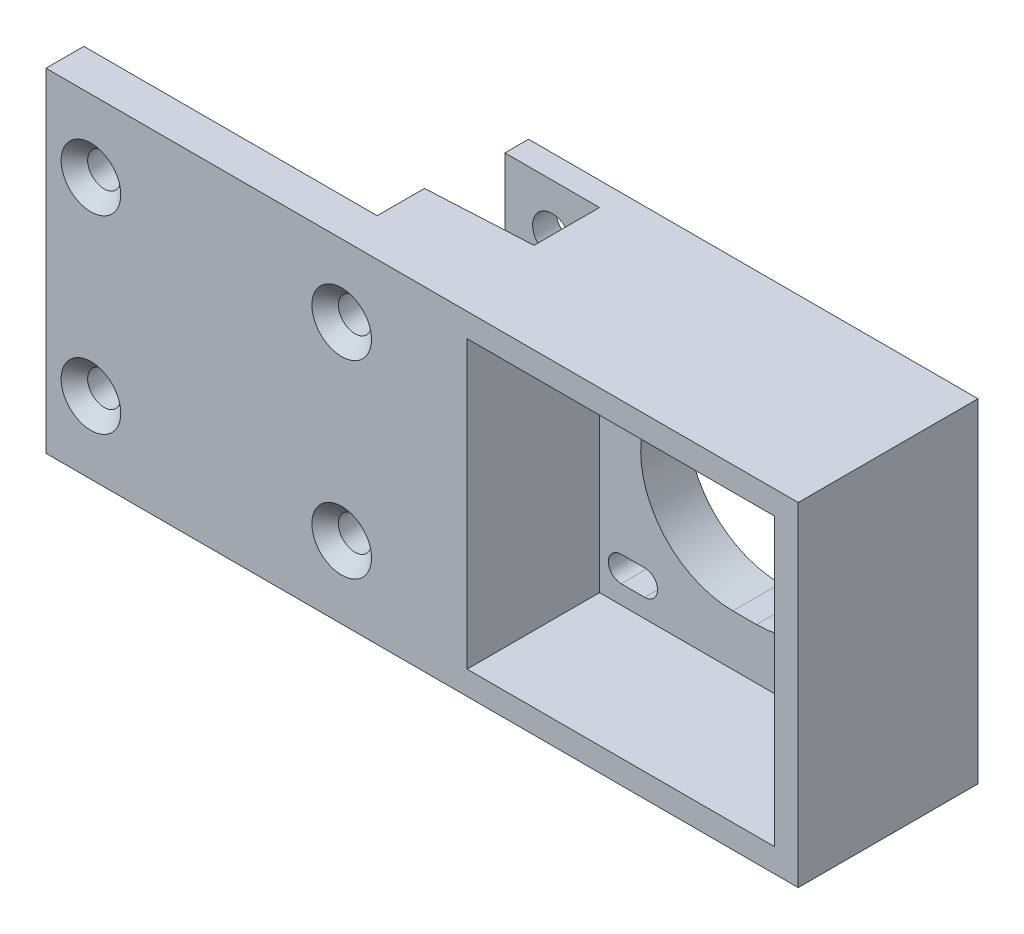
from build123d import *

# Parameters (mm, degrees)
SKETCH1_W                                           = 89
SKETCH1_H                                           = 70.5
SKETCH1_R                                           = 2.5
BOSS_EXTRUDE1_DEPTH                                 = 8
SKETCH2_W                                           = 38
SKETCH2_H                                           = 70.5
BOSS_EXTRUDE2_DEPTH                                 = 5
BOSS_EXTRUDE3_DEPTH                                 = 5
SKETCH17_W                                          = 65
SKETCH17_H                                          = 70.5
BOSS_EXTRUDE6_DEPTH                                 = 5
CUT_EXTRUDE1_REACH                                  = 171.004
SKETCH7_R                                           = 4.15
CUT_EXTRUDE1_DIRECTION_2_REACH                      = 171.004
CSK_FOR_M6_COUNTERSUNK_FLAT_HEAD_SCREW1_D           = 7
CSK_FOR_M6_COUNTERSUNK_FLAT_HEAD_SCREW1_DEPTH       = 8
CSK_FOR_M6_COUNTERSUNK_FLAT_HEAD_SCREW1_CSINK_D     = 12.6
CSK_FOR_M6_COUNTERSUNK_FLAT_HEAD_SCREW1_CSINK_ANGLE = 90
CSK_FOR_M6_COUNTERSUNK_FLAT_HEAD_SCREW1_TIP         = 2.103012167
RIB5_REACH                                          = 128.754
SKETCH15_WALL_W                                     = 280.507889424
SKETCH15_WALL_H                                     = 5
RIB5_DRAFT_ANGLE                                    = 20
SKETCH16_W                                          = 5
SKETCH16_H                                          = 38
BOSS_EXTRUDE5_DEPTH                                 = 70.5
RIB1_REACH                                          = 146.911
SKETCH6_WALL_W                                      = 356.822359386
SKETCH6_WALL_H                                      = 5
SKETCH19_W                                          = 22
SKETCH19_H                                          = 10
BOSS_EXTRUDE7_DEPTH                                 = 7
FILLET1_R                                           = 2.5


with BuildPart() as part:
    # Sketch1 → Boss-Extrude1 (new body)
    with BuildSketch(Plane.XY):
        with Locations((8.5, 81.151)):
            Rectangle(SKETCH1_W, SKETCH1_H)
        with Locations((26.5, 61.151)):
            Circle(SKETCH1_R, mode=Mode.SUBTRACT)
        with Locations((-26.5, 61.151)):
            Circle(SKETCH1_R, mode=Mode.SUBTRACT)
        with Locations((-26.5, 101.151)):
            Circle(SKETCH1_R, mode=Mode.SUBTRACT)
        with Locations((26.5, 101.151)):
            Circle(SKETCH1_R, mode=Mode.SUBTRACT)
    extrude(amount=BOSS_EXTRUDE1_DEPTH)

    # Sketch2 → Boss-Extrude2 (add)
    with BuildSketch(Plane(origin=(53, 0, 0), x_dir=(0, 0, -1), z_dir=(1, 0, 0))):
        with Locations((11, 81.151)):
            Rectangle(SKETCH2_W, SKETCH2_H)
    extrude(amount=-BOSS_EXTRUDE2_DEPTH)

    # Sketch3 → Boss-Extrude3 (add)
    with BuildSketch(Plane(origin=(0, 0, -30), x_dir=(-1, 0, 0), z_dir=(0, 0, -1))):
        Polygon((-48, 45.901), (-118, 45.901), (-118, 116.401), (-48, 116.401), (-28, 116.401), (-28, 45.901), align=None)
    extrude(amount=-BOSS_EXTRUDE3_DEPTH)

    # Sketch17 → Boss-Extrude6 (add)
    with BuildSketch(Plane.XY.offset(-25)):
        with Locations((85.5, 81.151)):
            Rectangle(SKETCH17_W, SKETCH17_H)
    extrude(amount=BOSS_EXTRUDE6_DEPTH)

    # Sketch7 → Cut-Extrude1 (cut, up to next)
    with BuildSketch(Plane.XY.offset(-25), mode=Mode.PRIVATE) as cut_extrude1_sk1:
        with BuildLine():
            ThreePointArc((81.2, 100.651), (61.7, 81.151), (81.2, 61.651))
            Line((81.2, 61.651), (86.2, 61.651))
            ThreePointArc((86.2, 61.651), (105.7, 81.151), (86.2, 100.651))
            Line((86.2, 100.651), (81.2, 100.651))
        make_face()
    cut_extrude1_tool1 = extrude(cut_extrude1_sk1.sketch, amount=-CUT_EXTRUDE1_REACH, mode=Mode.PRIVATE) & part.part
    # Sketch7 → Cut-Extrude1 (cut, up to next)
    with BuildSketch(Plane.XY.offset(-25), mode=Mode.PRIVATE) as cut_extrude1_sk2:
        with BuildLine():
            Line((62.57, 107.481), (57.57, 107.481))
            ThreePointArc((57.57, 107.481), (54.87, 104.781), (57.57, 102.081))
            Line((57.57, 102.081), (62.57, 102.081))
            ThreePointArc((62.57, 102.081), (65.27, 104.781), (62.57, 107.481))
        make_face()
    cut_extrude1_tool2 = extrude(cut_extrude1_sk2.sketch, amount=-CUT_EXTRUDE1_REACH, mode=Mode.PRIVATE) & part.part
    # Sketch7 → Cut-Extrude1 (cut, up to next)
    with BuildSketch(Plane.XY.offset(-25), mode=Mode.PRIVATE) as cut_extrude1_sk3:
        with BuildLine():
            ThreePointArc((104.83, 107.481), (102.13, 104.781), (104.83, 102.081))
            Line((104.83, 102.081), (109.83, 102.081))
            ThreePointArc((109.83, 102.081), (112.53, 104.781), (109.83, 107.481))
            Line((109.83, 107.481), (104.83, 107.481))
        make_face()
    cut_extrude1_tool3 = extrude(cut_extrude1_sk3.sketch, amount=-CUT_EXTRUDE1_REACH, mode=Mode.PRIVATE) & part.part
    # Sketch7 → Cut-Extrude1 (cut, up to next)
    with BuildSketch(Plane.XY.offset(-25), mode=Mode.PRIVATE) as cut_extrude1_sk4:
        with BuildLine():
            Line((104.83, 54.821), (109.83, 54.821))
            ThreePointArc((109.83, 54.821), (112.53, 57.521), (109.83, 60.221))
            Line((109.83, 60.221), (104.83, 60.221))
            ThreePointArc((104.83, 60.221), (102.13, 57.521), (104.83, 54.821))
        make_face()
    cut_extrude1_tool4 = extrude(cut_extrude1_sk4.sketch, amount=-CUT_EXTRUDE1_REACH, mode=Mode.PRIVATE) & part.part
    # Sketch7 → Cut-Extrude1 (cut, up to next)
    with BuildSketch(Plane.XY.offset(-25), mode=Mode.PRIVATE) as cut_extrude1_sk5:
        with BuildLine():
            ThreePointArc((62.57, 54.821), (65.27, 57.521), (62.57, 60.221))
            Line((62.57, 60.221), (57.57, 60.221))
            ThreePointArc((57.57, 60.221), (54.87, 57.521), (57.57, 54.821))
            Line((57.57, 54.821), (62.57, 54.821))
        make_face()
    cut_extrude1_tool5 = extrude(cut_extrude1_sk5.sketch, amount=-CUT_EXTRUDE1_REACH, mode=Mode.PRIVATE) & part.part
    # Sketch7 → Cut-Extrude1 (cut, up to next)
    with BuildSketch(Plane.XY.offset(-25), mode=Mode.PRIVATE) as cut_extrude1_sk6:
        with Locations(Location((38, 106.151, 0), (0, 0, 90))):
            Circle(SKETCH7_R)
    cut_extrude1_tool6 = extrude(cut_extrude1_sk6.sketch, amount=-CUT_EXTRUDE1_REACH, mode=Mode.PRIVATE) & part.part
    # Sketch7 → Cut-Extrude1 (cut, up to next)
    with BuildSketch(Plane.XY.offset(-25), mode=Mode.PRIVATE) as cut_extrude1_sk7:
        with Locations(Location((38, 56.151, 0), (0, 0, 90))):
            Circle(SKETCH7_R)
    cut_extrude1_tool7 = extrude(cut_extrude1_sk7.sketch, amount=-CUT_EXTRUDE1_REACH, mode=Mode.PRIVATE) & part.part
    add(cut_extrude1_tool1.solids().sort_by_distance((83.7, 81.151, -25))[0], mode=Mode.SUBTRACT)
    add(cut_extrude1_tool2.solids().sort_by_distance((60.07, 104.781, -25))[0], mode=Mode.SUBTRACT)
    add(cut_extrude1_tool3.solids().sort_by_distance((107.33, 104.781, -25))[0], mode=Mode.SUBTRACT)
    add(cut_extrude1_tool4.solids().sort_by_distance((107.33, 57.521, -25))[0], mode=Mode.SUBTRACT)
    add(cut_extrude1_tool5.solids().sort_by_distance((60.07, 57.521, -25))[0], mode=Mode.SUBTRACT)
    add(cut_extrude1_tool6.solids().sort_by_distance((38, 106.151, -25))[0], mode=Mode.SUBTRACT)
    add(cut_extrude1_tool7.solids().sort_by_distance((38, 56.151, -25))[0], mode=Mode.SUBTRACT)

    # Cut-Extrude1 direction 2: up to this face of the body (flat: up to its plane)
    cut_extrude1_direction_2_end = Plane(part.part.faces().sort_by_distance((85.5, 81.151, -20))[0])
    # Sketch7 → Cut-Extrude1 direction 2 (cut, up to the picked face)
    with BuildSketch(Plane.XY.offset(-25), mode=Mode.PRIVATE) as cut_extrude1_direction_2_sk1:
        with BuildLine():
            ThreePointArc((81.2, 100.651), (61.7, 81.151), (81.2, 61.651))
            Line((81.2, 61.651), (86.2, 61.651))
            ThreePointArc((86.2, 61.651), (105.7, 81.151), (86.2, 100.651))
            Line((86.2, 100.651), (81.2, 100.651))
        make_face()
    cut_extrude1_direction_2_tool1 = split(extrude(cut_extrude1_direction_2_sk1.sketch, amount=CUT_EXTRUDE1_DIRECTION_2_REACH, mode=Mode.PRIVATE), bisect_by=cut_extrude1_direction_2_end, keep=Keep.BOTH, mode=Mode.PRIVATE)
    # Sketch7 → Cut-Extrude1 direction 2 (cut, up to the picked face)
    with BuildSketch(Plane.XY.offset(-25), mode=Mode.PRIVATE) as cut_extrude1_direction_2_sk2:
        with BuildLine():
            Line((62.57, 107.481), (57.57, 107.481))
            ThreePointArc((57.57, 107.481), (54.87, 104.781), (57.57, 102.081))
            Line((57.57, 102.081), (62.57, 102.081))
            ThreePointArc((62.57, 102.081), (65.27, 104.781), (62.57, 107.481))
        make_face()
    cut_extrude1_direction_2_tool2 = split(extrude(cut_extrude1_direction_2_sk2.sketch, amount=CUT_EXTRUDE1_DIRECTION_2_REACH, mode=Mode.PRIVATE), bisect_by=cut_extrude1_direction_2_end, keep=Keep.BOTH, mode=Mode.PRIVATE)
    # Sketch7 → Cut-Extrude1 direction 2 (cut, up to the picked face)
    with BuildSketch(Plane.XY.offset(-25), mode=Mode.PRIVATE) as cut_extrude1_direction_2_sk3:
        with BuildLine():
            ThreePointArc((104.83, 107.481), (102.13, 104.781), (104.83, 102.081))
            Line((104.83, 102.081), (109.83, 102.081))
            ThreePointArc((109.83, 102.081), (112.53, 104.781), (109.83, 107.481))
            Line((109.83, 107.481), (104.83, 107.481))
        make_face()
    cut_extrude1_direction_2_tool3 = split(extrude(cut_extrude1_direction_2_sk3.sketch, amount=CUT_EXTRUDE1_DIRECTION_2_REACH, mode=Mode.PRIVATE), bisect_by=cut_extrude1_direction_2_end, keep=Keep.BOTH, mode=Mode.PRIVATE)
    # Sketch7 → Cut-Extrude1 direction 2 (cut, up to the picked face)
    with BuildSketch(Plane.XY.offset(-25), mode=Mode.PRIVATE) as cut_extrude1_direction_2_sk4:
        with BuildLine():
            Line((104.83, 54.821), (109.83, 54.821))
            ThreePointArc((109.83, 54.821), (112.53, 57.521), (109.83, 60.221))
            Line((109.83, 60.221), (104.83, 60.221))
            ThreePointArc((104.83, 60.221), (102.13, 57.521), (104.83, 54.821))
        make_face()
    cut_extrude1_direction_2_tool4 = split(extrude(cut_extrude1_direction_2_sk4.sketch, amount=CUT_EXTRUDE1_DIRECTION_2_REACH, mode=Mode.PRIVATE), bisect_by=cut_extrude1_direction_2_end, keep=Keep.BOTH, mode=Mode.PRIVATE)
    # Sketch7 → Cut-Extrude1 direction 2 (cut, up to the picked face)
    with BuildSketch(Plane.XY.offset(-25), mode=Mode.PRIVATE) as cut_extrude1_direction_2_sk5:
        with BuildLine():
            ThreePointArc((62.57, 54.821), (65.27, 57.521), (62.57, 60.221))
            Line((62.57, 60.221), (57.57, 60.221))
            ThreePointArc((57.57, 60.221), (54.87, 57.521), (57.57, 54.821))
            Line((57.57, 54.821), (62.57, 54.821))
        make_face()
    cut_extrude1_direction_2_tool5 = split(extrude(cut_extrude1_direction_2_sk5.sketch, amount=CUT_EXTRUDE1_DIRECTION_2_REACH, mode=Mode.PRIVATE), bisect_by=cut_extrude1_direction_2_end, keep=Keep.BOTH, mode=Mode.PRIVATE)
    # Sketch7 → Cut-Extrude1 direction 2 (cut, up to the picked face)
    with BuildSketch(Plane.XY.offset(-25), mode=Mode.PRIVATE) as cut_extrude1_direction_2_sk6:
        with Locations(Location((38, 106.151, 0), (0, 0, 90))):
            Circle(SKETCH7_R)
    cut_extrude1_direction_2_tool6 = split(extrude(cut_extrude1_direction_2_sk6.sketch, amount=CUT_EXTRUDE1_DIRECTION_2_REACH, mode=Mode.PRIVATE), bisect_by=cut_extrude1_direction_2_end, keep=Keep.BOTH, mode=Mode.PRIVATE)
    # Sketch7 → Cut-Extrude1 direction 2 (cut, up to the picked face)
    with BuildSketch(Plane.XY.offset(-25), mode=Mode.PRIVATE) as cut_extrude1_direction_2_sk7:
        with Locations(Location((38, 56.151, 0), (0, 0, 90))):
            Circle(SKETCH7_R)
    cut_extrude1_direction_2_tool7 = split(extrude(cut_extrude1_direction_2_sk7.sketch, amount=CUT_EXTRUDE1_DIRECTION_2_REACH, mode=Mode.PRIVATE), bisect_by=cut_extrude1_direction_2_end, keep=Keep.BOTH, mode=Mode.PRIVATE)
    add(cut_extrude1_direction_2_tool1.solids().sort_by(Axis((83.7, 81.151, -25), (0, 0, 1)))[0], mode=Mode.SUBTRACT)
    add(cut_extrude1_direction_2_tool2.solids().sort_by(Axis((60.07, 104.781, -25), (0, 0, 1)))[0], mode=Mode.SUBTRACT)
    add(cut_extrude1_direction_2_tool3.solids().sort_by(Axis((107.33, 104.781, -25), (0, 0, 1)))[0], mode=Mode.SUBTRACT)
    add(cut_extrude1_direction_2_tool4.solids().sort_by(Axis((107.33, 57.521, -25), (0, 0, 1)))[0], mode=Mode.SUBTRACT)
    add(cut_extrude1_direction_2_tool5.solids().sort_by(Axis((60.07, 57.521, -25), (0, 0, 1)))[0], mode=Mode.SUBTRACT)
    add(cut_extrude1_direction_2_tool6.solids().sort_by(Axis((38, 106.151, -25), (0, 0, 1)))[0], mode=Mode.SUBTRACT)
    add(cut_extrude1_direction_2_tool7.solids().sort_by(Axis((38, 56.151, -25), (0, 0, 1)))[0], mode=Mode.SUBTRACT)

    # CSK for M6 Countersunk Flat Head Screw1
    with Locations(Plane.XY.offset(8)):
        with Locations((-26.5, 101.151), (-26.5, 61.151), (26.5, 61.151), (26.5, 101.151)):
            CounterSinkHole(CSK_FOR_M6_COUNTERSUNK_FLAT_HEAD_SCREW1_D / 2, CSK_FOR_M6_COUNTERSUNK_FLAT_HEAD_SCREW1_CSINK_D / 2, depth=CSK_FOR_M6_COUNTERSUNK_FLAT_HEAD_SCREW1_DEPTH, counter_sink_angle=CSK_FOR_M6_COUNTERSUNK_FLAT_HEAD_SCREW1_CSINK_ANGLE)
            with Locations((0, 0, -(CSK_FOR_M6_COUNTERSUNK_FLAT_HEAD_SCREW1_DEPTH + CSK_FOR_M6_COUNTERSUNK_FLAT_HEAD_SCREW1_TIP / 2))):  # 118° drill point
                Cone(0, CSK_FOR_M6_COUNTERSUNK_FLAT_HEAD_SCREW1_D / 2, CSK_FOR_M6_COUNTERSUNK_FLAT_HEAD_SCREW1_TIP, mode=Mode.SUBTRACT)

    # Sketch15 wall → Rib5 (add, up to next)
    with BuildSketch(Plane(origin=(34, 81.151, -12.5), x_dir=(0, 0, 1), z_dir=(1, 0, 0)), mode=Mode.PRIVATE) as rib5_sk1:
        Rectangle(SKETCH15_WALL_W, SKETCH15_WALL_H)
    rib5_tool1 = extrude(rib5_sk1.sketch, amount=RIB5_REACH, mode=Mode.PRIVATE) - part.part
    add(rib5_tool1.solids().sort_by_distance((34, 81.151, -12.5))[0])

    # Rib5 draft
    rib5_draft_faces = [part.faces().sort_by_distance(p)[0] for p in [
        (34.5, 78.651, -12.5),
        (34.5, 83.651, -12.5),
    ]]
    draft(rib5_draft_faces, Plane(origin=(34, 81.151, -12.5), x_dir=(0, 0, 1), z_dir=(-1, 0, 0)), RIB5_DRAFT_ANGLE)

    # Sketch16 → Boss-Extrude5 (add)
    with BuildSketch(Plane.XZ.offset(-45.901)):
        with Locations((120.5, -11)):
            Rectangle(SKETCH16_W, SKETCH16_H)
    extrude(amount=-BOSS_EXTRUDE5_DEPTH)

    # Sketch6 wall → Rib1 (add, up to next)
    with BuildSketch(Plane(origin=(85.5, 116.401, 8), x_dir=(1, 0, 0), z_dir=(0, 0, -1)), mode=Mode.PRIVATE) as rib1_sk1:
        with Locations((0, 2.5)):
            Rectangle(SKETCH6_WALL_W, SKETCH6_WALL_H)
    rib1_tool1 = extrude(rib1_sk1.sketch, amount=RIB1_REACH, mode=Mode.PRIVATE) - part.part
    rib1 = rib1_tool1.solids().sort_by_distance((85.5, 116.401, 8))[0]
    add(rib1)

    # Sketch19 → Boss-Extrude7 (add)
    with BuildSketch(Plane(origin=(0, 116.401, 0), x_dir=(1, 0, 0), z_dir=(0, 1, 0))):
        with Locations((37, 5)):
            Rectangle(SKETCH19_W, SKETCH19_H)
        Polygon((26, 10), (48, 10), (48, 11.152971144), align=None)
    boss_extrude7 = extrude(amount=-BOSS_EXTRUDE7_DEPTH)

    # Mirror5: Rib1 across plane
    add(rib1.mirror(Plane.ZX.offset(81.151)))

    # Mirror6: Boss-Extrude7 across plane
    add(boss_extrude7.mirror(Plane.ZX.offset(81.151)))

    # Fillet1
    fillet1_edges = [part.edges().sort_by_distance(p)[0] for p in [
        (48, 63.22820836, 0),
        (34, 81.151, -25),
        (34, 78.651, -12.5),
        (34, 81.151, 0),
        (41, 86.19879164, -25),
        (48, 88.74658328, -12.5),
        (41, 76.10320836, 0),
        (34, 83.651, -12.5),
        (41, 86.19879164, 0),
        (41, 76.10320836, -25),
        (48, 73.55541672, -12.5),
        (48, 99.07379164, 0),
    ]]
    fillet(fillet1_edges, radius=FILLET1_R)


solid = part.part
